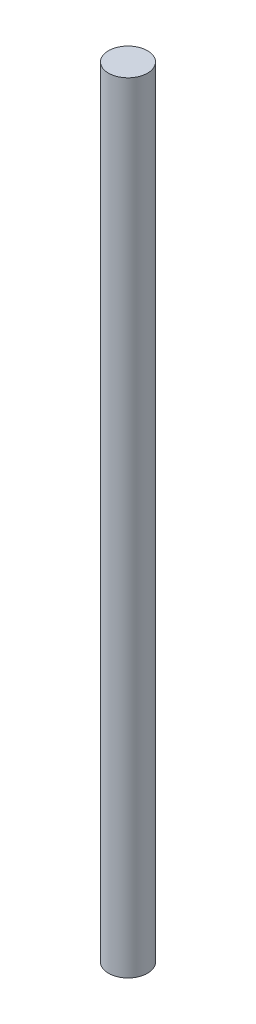
from build123d import *

# Parameters (mm, degrees)
SKETCH_1_R      = 2.5
EXTRUDE_1_DEPTH = 100


with BuildPart() as part:
    # 草图1 → 凸台-拉伸1 (new body)
    with BuildSketch(Plane(origin=(0, 0, 0), x_dir=(1, 0, 0), z_dir=(0, 1, 0))):
        with Locations(Location((0, 0, 0), (0, 0, 270))):
            Circle(SKETCH_1_R)
    extrude(amount=EXTRUDE_1_DEPTH)


solid = part.part
